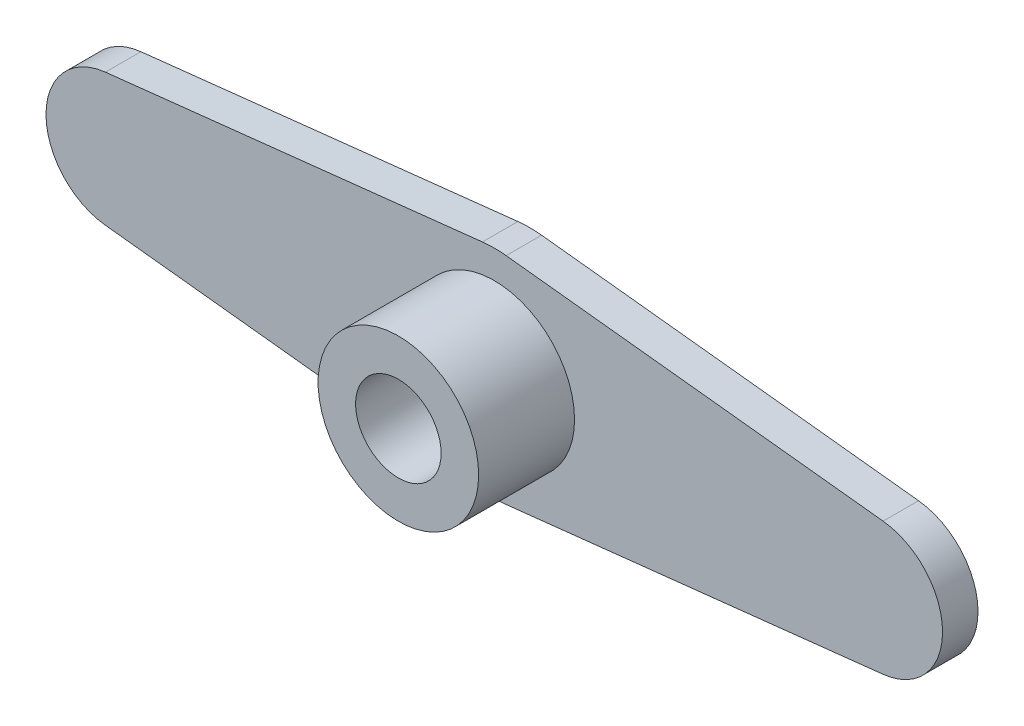
from build123d import *

# Parameters (mm, degrees)
BOSS_EXTRUDE1_DEPTH = 2.159
SKETCH2_R           = 4.8895
SKETCH2_R_2         = 2.6035
BOSS_EXTRUDE2_DEPTH = 5.842


with BuildPart() as part:
    # Sketch1 → Boss-Extrude1 (new body)
    with BuildSketch(Plane.XY):
        with BuildLine():
            Line((-23.685153005, 4.039656434), (-0.721748634, 6.564441706))
            ThreePointArc((-0.721748634, 6.564441706), (0, 6.604), (0.721748634, 6.564441706))
            Line((0.721748634, 6.564441706), (23.685153005, 4.039656434))
            ThreePointArc((23.685153005, 4.039656434), (27.305, 0), (23.685153005, -4.039656434))
            Line((23.685153005, -4.039656434), (0.721748634, -6.564441706))
            ThreePointArc((0.721748634, -6.564441706), (0, -6.604), (-0.721748634, -6.564441706))
            Line((-0.721748634, -6.564441706), (-23.685153005, -4.039656434))
            ThreePointArc((-23.685153005, -4.039656434), (-27.305, 0), (-23.685153005, 4.039656434))
        make_face()
    extrude(amount=BOSS_EXTRUDE1_DEPTH)

    # Sketch2 → Boss-Extrude2 (add)
    with BuildSketch(Plane.XY.offset(2.159)):
        Circle(SKETCH2_R)
        Circle(SKETCH2_R_2, mode=Mode.SUBTRACT)
    extrude(amount=BOSS_EXTRUDE2_DEPTH)


solid = part.part
